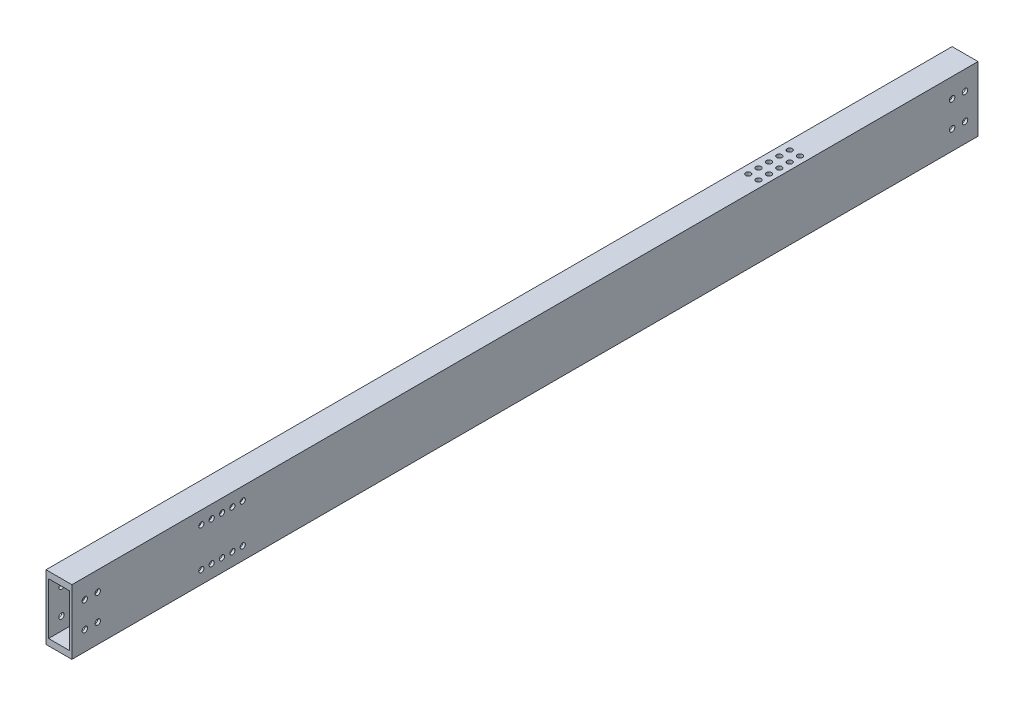
from build123d import *

# Parameters (mm, degrees)
SKETCH_1_W          = 20
SKETCH_1_H          = 50
SKETCH_1_W_2        = 16
SKETCH_1_H_2        = 40
EXTRUDE_1_DEPTH     = 700
SKETCH_5_R          = 2.1
CUT_EXTRUDE_1_DEPTH = 701.731760376
SKETCH_6_R          = 2
CUT_EXTRUDE_3_DEPTH = 702.854685815
SKETCH_7_R          = 2
CUT_EXTRUDE_5_DEPTH = 701.731760376


with BuildPart() as part:
    # 草图1 → 凸台-拉伸1 (new body)
    with BuildSketch(Plane.XY):
        Rectangle(SKETCH_1_W, SKETCH_1_H)
        Rectangle(SKETCH_1_W_2, SKETCH_1_H_2, mode=Mode.SUBTRACT)
    extrude(amount=EXTRUDE_1_DEPTH)

    # 草图5 → 切除-拉伸1 (cut, through all)
    with BuildSketch(Plane.ZY.offset(10)):
        with Locations((10, 10)):
            Circle(SKETCH_5_R)
        with Locations((20, 10)):
            Circle(SKETCH_5_R)
        with Locations((10, -10)):
            Circle(SKETCH_5_R)
        with Locations((20, -10)):
            Circle(SKETCH_5_R)
    cut_extrude_1 = extrude(amount=-CUT_EXTRUDE_1_DEPTH, mode=Mode.SUBTRACT)

    # 镜向1: 切除-拉伸1 across plane
    add(cut_extrude_1.mirror(Plane(origin=(-40, 280, 350), x_dir=(1, 0, 0), z_dir=(0, 0, -1))), mode=Mode.SUBTRACT)

    # 草图6 → 切除-拉伸3 (cut, through all)
    with BuildSketch(Plane.XZ.offset(25)):
        with Locations(Location((-3.5, 132, 0), (0, 0, 270))):
            Circle(SKETCH_6_R)
        with Locations(Location((4.5, 132, 0), (0, 0, 270))):
            Circle(SKETCH_6_R)
        with Locations(Location((4.5, 140, 0), (0, 0, 270))):
            Circle(SKETCH_6_R)
        with Locations(Location((4.5, 148, 0), (0, 0, 270))):
            Circle(SKETCH_6_R)
        with Locations(Location((4.5, 156, 0), (0, 0, 270))):
            Circle(SKETCH_6_R)
        with Locations(Location((4.5, 164, 0), (0, 0, 270))):
            Circle(SKETCH_6_R)
        with Locations(Location((-3.5, 140, 0), (0, 0, 270))):
            Circle(SKETCH_6_R)
        with Locations(Location((-3.5, 148, 0), (0, 0, 270))):
            Circle(SKETCH_6_R)
        with Locations(Location((-3.5, 156, 0), (0, 0, 270))):
            Circle(SKETCH_6_R)
        with Locations(Location((-3.5, 164, 0), (0, 0, 270))):
            Circle(SKETCH_6_R)
    extrude(amount=-CUT_EXTRUDE_3_DEPTH, mode=Mode.SUBTRACT)

    # 草图7 → 切除-拉伸5 (cut, through all)
    with BuildSketch(Plane.ZY.offset(10)):
        with Locations((600, 15)):
            Circle(SKETCH_7_R)
        with Locations((592, 15)):
            Circle(SKETCH_7_R)
        with Locations((584, 15)):
            Circle(SKETCH_7_R)
        with Locations((576, 15)):
            Circle(SKETCH_7_R)
        with Locations((568, 15)):
            Circle(SKETCH_7_R)
        with Locations(Location((592, -15, 0), (0, 0, 180))):
            Circle(SKETCH_7_R)
        with Locations(Location((584, -15, 0), (0, 0, 180))):
            Circle(SKETCH_7_R)
        with Locations(Location((576, -15, 0), (0, 0, 180))):
            Circle(SKETCH_7_R)
        with Locations(Location((568, -15, 0), (0, 0, 180))):
            Circle(SKETCH_7_R)
        with Locations(Location((600, -15, 0), (0, 0, 180))):
            Circle(SKETCH_7_R)
    extrude(amount=-CUT_EXTRUDE_5_DEPTH, mode=Mode.SUBTRACT)


solid = part.part
